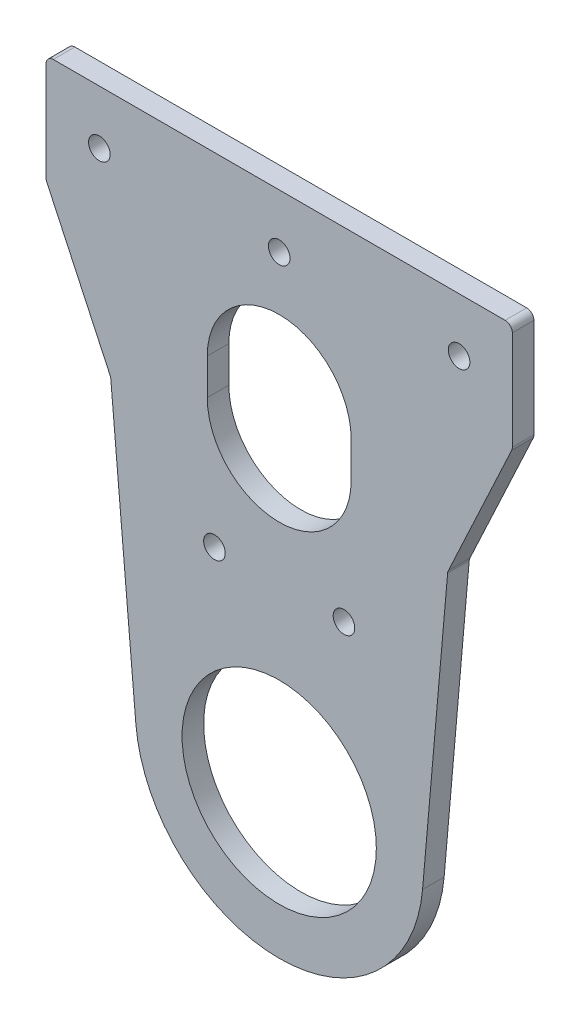
from build123d import *

# Parameters (mm, degrees)
SKETCH_1_R      = 1.5
SKETCH_1_R_2    = 13.5
EXTRUDE_1_DEPTH = 3
FILLET_2_R      = 1


with BuildPart() as part:
    # 草图1 → 凸台-拉伸1 (new body)
    with BuildSketch(Plane.XY):
        with BuildLine():
            Line((-32.4, 72.5), (32.4, 72.5))
            Line((32.4, 72.5), (32.4, 57.5))
            Line((32.4, 57.5), (23.422667354, 38.248048013))
            Line((23.422667354, 38.248048013), (19.923893962, -1.743114855))
            ThreePointArc((19.923893962, -1.743114855), (0, -20), (-19.923893962, -1.743114855))
            Line((-19.923893962, -1.743114855), (-23.422667354, 38.248048013))
            Line((-23.422667354, 38.248048013), (-32.4, 57.5))
            Line((-32.4, 57.5), (-32.4, 72.5))
        make_face()
        with Locations((25, 65)):
            Circle(SKETCH_1_R, mode=Mode.SUBTRACT)
        with Locations((-25, 65)):
            Circle(SKETCH_1_R, mode=Mode.SUBTRACT)
        with Locations((0, 65)):
            Circle(SKETCH_1_R, mode=Mode.SUBTRACT)
        Circle(SKETCH_1_R_2, mode=Mode.SUBTRACT)
        with Locations((-9, 25)):
            Circle(SKETCH_1_R, mode=Mode.SUBTRACT)
        with Locations((9, 25)):
            Circle(SKETCH_1_R, mode=Mode.SUBTRACT)
        with BuildLine():
            Line((10, 47.5), (10, 42.5))
            ThreePointArc((10, 42.5), (0, 32.5), (-10, 42.5))
            Line((-10, 42.5), (-10, 47.5))
            ThreePointArc((-10, 47.5), (0, 57.5), (10, 47.5))
        make_face(mode=Mode.SUBTRACT)
    extrude(amount=EXTRUDE_1_DEPTH)

    # 圆角2
    fillet_2_edges = [part.edges().sort_by_distance(p)[0] for p in [
        (23.422667354, 38.248048013, 1.5),
        (-23.422667354, 38.248048013, 1.5),
        (-32.4, 57.5, 1.5),
        (-32.4, 72.5, 1.5),
        (32.4, 72.5, 1.5),
        (32.4, 57.5, 1.5),
    ]]
    fillet(fillet_2_edges, radius=FILLET_2_R)


solid = part.part
